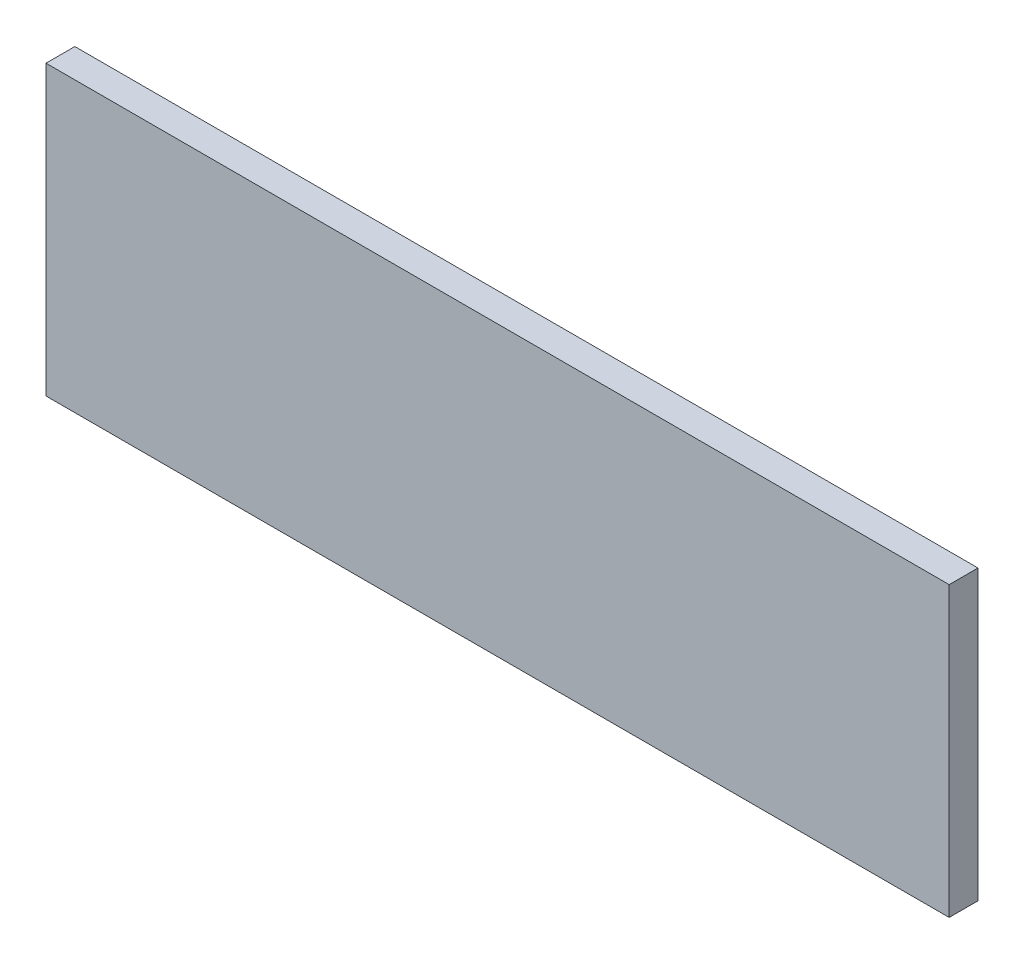
from build123d import *

# Parameters (mm, degrees)
ESQUISSE1_W        = 188
ESQUISSE1_H        = 60
BOSS_EXTRU_1_DEPTH = 6


with BuildPart() as part:
    # Esquisse1 → Boss.-Extru.1 (new body)
    with BuildSketch(Plane.XY):
        Rectangle(ESQUISSE1_W, ESQUISSE1_H)
    extrude(amount=BOSS_EXTRU_1_DEPTH)


solid = part.part
